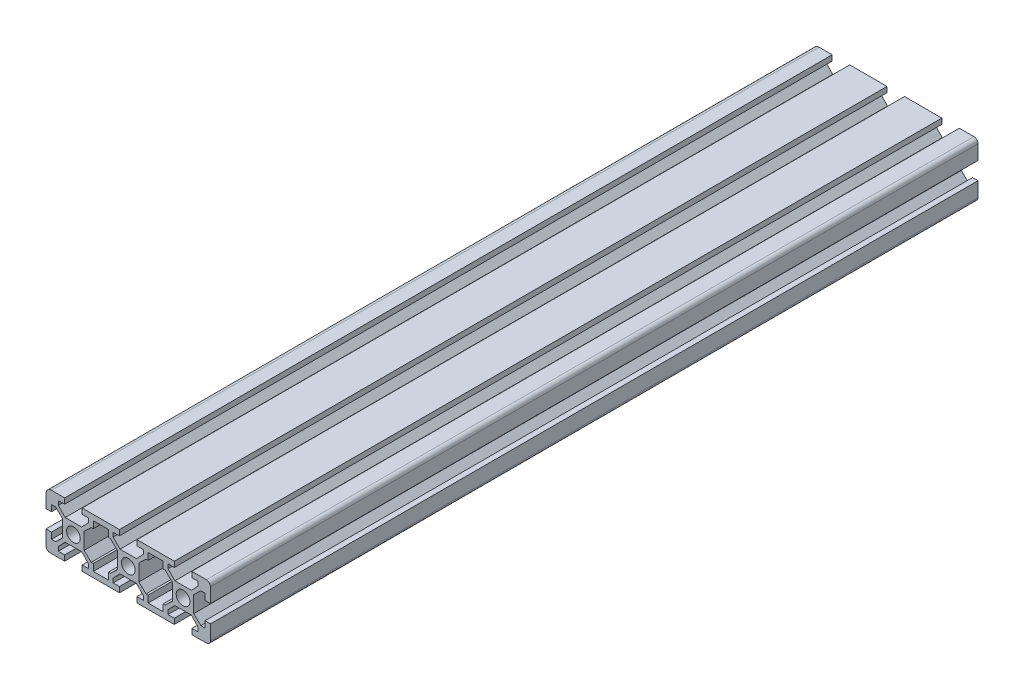
from build123d import *

# Parameters (mm, degrees)
SKETCH_1_R      = 2.5
EXTRUDE_2_DEPTH = 280


with BuildPart() as part:
    # 草图1 → 凸台-拉伸2 (new body)
    with BuildSketch(Plane.XY):
        with BuildLine():
            Line((-23.2, 10), (-28, 10))
            ThreePointArc((-28, 10), (-29.414213562, 9.414213562), (-30, 8))
            Line((-30, 8), (-30, 3.2))
            Line((-30, 3.2), (-28, 3.2))
            Line((-28, 3.2), (-28, 5.5))
            Line((-28, 5.5), (-26.5, 5.5))
            Line((-26.5, 5.5), (-23.9, 3))
            Line((-23.9, 3), (-23.9, -3))
            Line((-23.9, -3), (-26.5, -5.5))
            Line((-26.5, -5.5), (-28, -5.5))
            Line((-28, -5.5), (-28, -3.2))
            Line((-28, -3.2), (-30, -3.2))
            Line((-30, -3.2), (-30, -8.5))
            ThreePointArc((-30, -8.5), (-29.560660172, -9.560660172), (-28.5, -10))
            Line((-28.5, -10), (-23.2, -10))
            Line((-23.2, -10), (-23.2, -8))
            Line((-23.2, -8), (-25.5, -8))
            Line((-25.5, -8), (-25.5, -6.5))
            Line((-25.5, -6.5), (-23, -3.9))
            Line((-23, -3.9), (-17, -3.9))
            Line((-17, -3.9), (-14.5, -6.5))
            Line((-14.5, -6.5), (-14.5, -8))
            Line((-14.5, -8), (-16.8, -8))
            Line((-16.8, -8), (-16.8, -10))
            Line((-16.8, -10), (-3.2, -10))
            Line((-3.2, -10), (-3.2, -8))
            Line((-3.2, -8), (-5.5, -8))
            Line((-5.5, -8), (-5.5, -6.5))
            Line((-5.5, -6.5), (-3, -3.9))
            Line((-3, -3.9), (3, -3.9))
            Line((3, -3.9), (5.5, -6.5))
            Line((5.5, -6.5), (5.5, -8))
            Line((5.5, -8), (3.2, -8))
            Line((3.2, -8), (3.2, -10))
            Line((3.2, -10), (16.8, -10))
            Line((16.8, -10), (16.8, -8))
            Line((16.8, -8), (14.5, -8))
            Line((14.5, -8), (14.5, -6.5))
            Line((14.5, -6.5), (17, -3.9))
            Line((17, -3.9), (23, -3.9))
            Line((23, -3.9), (25.5, -6.5))
            Line((25.5, -6.5), (25.5, -8))
            Line((25.5, -8), (23.2, -8))
            Line((23.2, -8), (23.2, -10))
            Line((23.2, -10), (28.5, -10))
            ThreePointArc((28.5, -10), (29.560660172, -9.560660172), (30, -8.5))
            Line((30, -8.5), (30, -3.2))
            Line((30, -3.2), (28, -3.2))
            Line((28, -3.2), (28, -5.5))
            Line((28, -5.5), (26.5, -5.5))
            Line((26.5, -5.5), (23.9, -3))
            Line((23.9, -3), (23.9, 3))
            Line((23.9, 3), (26.5, 5.5))
            Line((26.5, 5.5), (28, 5.5))
            Line((28, 5.5), (28, 3.2))
            Line((28, 3.2), (30, 3.2))
            Line((30, 3.2), (30, 8.5))
            ThreePointArc((30, 8.5), (29.560660172, 9.560660172), (28.5, 10))
            Line((28.5, 10), (23.2, 10))
            Line((23.2, 10), (23.2, 8))
            Line((23.2, 8), (25.5, 8))
            Line((25.5, 8), (25.5, 6.5))
            Line((25.5, 6.5), (23, 3.9))
            Line((23, 3.9), (17, 3.9))
            Line((17, 3.9), (14.5, 6.5))
            Line((14.5, 6.5), (14.5, 8))
            Line((14.5, 8), (16.8, 8))
            Line((16.8, 8), (16.8, 10))
            Line((16.8, 10), (3.2, 10))
            Line((3.2, 10), (3.2, 8))
            Line((3.2, 8), (5.5, 8))
            Line((5.5, 8), (5.5, 6.5))
            Line((5.5, 6.5), (3, 3.9))
            Line((3, 3.9), (-3, 3.9))
            Line((-3, 3.9), (-5.5, 6.5))
            Line((-5.5, 6.5), (-5.5, 8))
            Line((-5.5, 8), (-3.2, 8))
            Line((-3.2, 8), (-3.2, 10))
            Line((-3.2, 10), (-16.8, 10))
            Line((-16.8, 10), (-16.8, 8))
            Line((-16.8, 8), (-14.5, 8))
            Line((-14.5, 8), (-14.5, 6.5))
            Line((-14.5, 6.5), (-17, 3.9))
            Line((-17, 3.9), (-23, 3.9))
            Line((-23, 3.9), (-25.5, 6.5))
            Line((-25.5, 6.5), (-25.5, 8))
            Line((-25.5, 8), (-23.2, 8))
            Line((-23.2, 8), (-23.2, 10))
        make_face()
        Polygon((-12.75, -8), (-12.75, -5.5), (-13.5, -5.5), (-16.1, -3), (-16.1, 3), (-13.5, 5.5), (-12.75, 5.5), (-12.75, 8), (-7.25, 8), (-7.25, 5.5), (-6.5, 5.5), (-3.9, 3), (-3.9, -3), (-6.5, -5.5), (-7.25, -5.5), (-7.25, -8), align=None, mode=Mode.SUBTRACT)
        Polygon((6.5, -5.5), (3.9, -3), (3.9, 3), (6.5, 5.5), (7.25, 5.5), (7.25, 8), (12.75, 8), (12.75, 5.5), (13.5, 5.5), (16.1, 3), (16.1, -3), (13.5, -5.5), (12.75, -5.5), (12.75, -8), (7.25, -8), (7.25, -5.5), align=None, mode=Mode.SUBTRACT)
        with Locations((20, 0)):
            Circle(SKETCH_1_R, mode=Mode.SUBTRACT)
        with Locations((-20, 0)):
            Circle(SKETCH_1_R, mode=Mode.SUBTRACT)
        Circle(SKETCH_1_R, mode=Mode.SUBTRACT)
    extrude(amount=EXTRUDE_2_DEPTH)


solid = part.part
